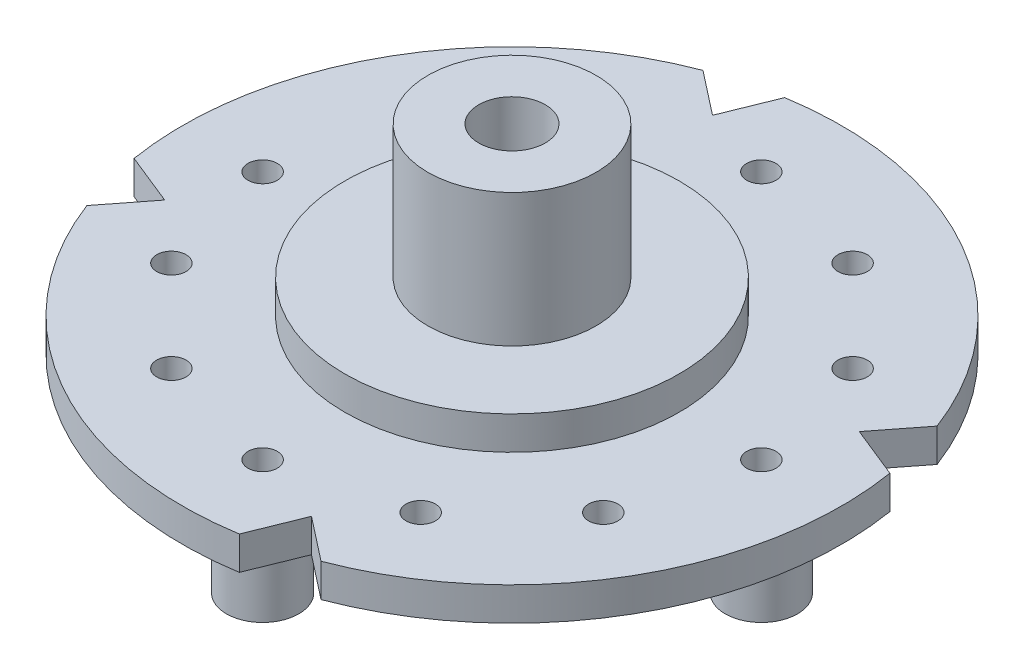
from build123d import *

# Parameters (mm, degrees)
SKETCH4_R           = 4.699
BOSS_EXTRUDE1_DEPTH = 10.668
SKETCH2_R           = 1.905
CUT_EXTRUDE1_DEPTH  = 65.262250988
CUT_EXTRUDE2_DEPTH  = 66.838691254


with BuildPart() as part:
    # Sketch1 → Revolve1 (revolve)
    with BuildSketch(Plane.XY, mode=Mode.PRIVATE) as revolve1_sk:
        Polygon((-42.799, 0), (0, 0), (0, 4.572), (-4.318, 4.572), (-4.318, 25.908), (-10.922, 25.908), (-10.922, 8.636), (-21.717, 8.636), (-21.717, 4.318), (-42.799, 4.318), align=None)
    revolve(revolve1_sk.sketch.rotate(Axis((0, 25.908, 0), (0, -1, 0)), 270), axis=Axis((0, 25.908, 0), (0, -1, 0)))

    # Sketch4 → Boss-Extrude1 (add)
    with BuildSketch(Plane.XZ):
        with Locations(Location((0, 32.385, 0), (0, 0, 90))):
            Circle(SKETCH4_R)
        with Locations(Location((32.385, 0, 0), (0, 0, 90))):
            Circle(SKETCH4_R)
        with Locations(Location((0, -32.385, 0), (0, 0, 90))):
            Circle(SKETCH4_R)
        with Locations(Location((-32.385, 0, 0), (0, 0, 90))):
            Circle(SKETCH4_R)
    extrude(amount=BOSS_EXTRUDE1_DEPTH)

    # Sketch2 → Cut-Extrude1 (cut, through all)
    with BuildSketch(Plane(origin=(0, 4.318, 0), x_dir=(1, 0, 0), z_dir=(0, 1, 0))):
        with Locations(Location((-32.385, 0, 0), (0, 0, 270))):
            Circle(SKETCH2_R)
        with Locations(Location((-28.046232702, 16.1925, 0), (0, 0, 270))):
            Circle(SKETCH2_R)
        with Locations(Location((-16.1925, 28.046232702, 0), (0, 0, 270))):
            Circle(SKETCH2_R)
        with Locations(Location((0, 32.385, 0), (0, 0, 270))):
            Circle(SKETCH2_R)
        with Locations(Location((16.1925, 28.046232702, 0), (0, 0, 270))):
            Circle(SKETCH2_R)
        with Locations(Location((28.046232702, 16.1925, 0), (0, 0, 270))):
            Circle(SKETCH2_R)
        with Locations(Location((32.385, 0, 0), (0, 0, 270))):
            Circle(SKETCH2_R)
        with Locations(Location((28.046232702, -16.1925, 0), (0, 0, 270))):
            Circle(SKETCH2_R)
        with Locations(Location((16.1925, -28.046232702, 0), (0, 0, 270))):
            Circle(SKETCH2_R)
        with Locations(Location((0, -32.385, 0), (0, 0, 270))):
            Circle(SKETCH2_R)
        with Locations(Location((-16.1925, -28.046232702, 0), (0, 0, 270))):
            Circle(SKETCH2_R)
        with Locations(Location((-28.046232702, -16.1925, 0), (0, 0, 270))):
            Circle(SKETCH2_R)
    extrude(amount=-CUT_EXTRUDE1_DEPTH, mode=Mode.SUBTRACT)

    # Sketch3 → Cut-Extrude2 (cut, through all)
    with BuildSketch(Plane.XZ):
        with BuildLine():
            Line((-35.575048182, 9.532305431), (-40.007033608, 15.204988091))
            ThreePointArc((-40.007033608, 15.204988091), (-41.340659439, 11.077196311), (-42.249601481, 6.835610853))
            Line((-42.249601481, 6.835610853), (-35.575048182, 9.532305431))
        make_face()
        with BuildLine():
            ThreePointArc((15.204988091, 40.007033608), (11.077196311, 41.340659439), (6.835610853, 42.249601481))
            Line((6.835610853, 42.249601481), (9.532305431, 35.575048182))
            Line((9.532305431, 35.575048182), (15.204988091, 40.007033608))
        make_face()
        with BuildLine():
            ThreePointArc((40.007033608, -15.204988091), (41.340659439, -11.077196311), (42.249601481, -6.835610853))
            Line((42.249601481, -6.835610853), (35.575048182, -9.532305431))
            Line((35.575048182, -9.532305431), (40.007033608, -15.204988091))
        make_face()
        with BuildLine():
            Line((-9.532305431, -35.575048182), (-15.204988091, -40.007033608))
            ThreePointArc((-15.204988091, -40.007033608), (-11.077196311, -41.340659439), (-6.835610853, -42.249601481))
            Line((-6.835610853, -42.249601481), (-9.532305431, -35.575048182))
        make_face()
    extrude(amount=-CUT_EXTRUDE2_DEPTH, mode=Mode.SUBTRACT)


solid = part.part
